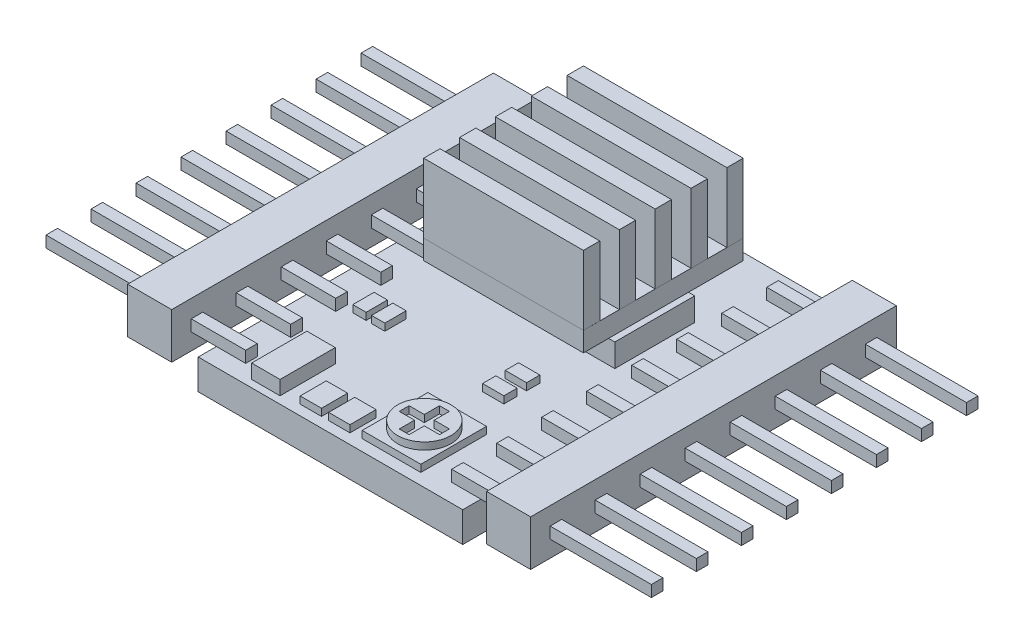
from build123d import *

# Parameters (mm, degrees)
SKETCH1_W            = 14.9
SKETCH1_H            = 20.45
BOARD_DEPTH          = 1.7
SKETCH2_W            = 11.25
SKETCH2_H            = 0.65
HEADERPINS_DEPTH     = 0.64
HEATSINK_START       = 1.3
SKETCH3_W            = 9
SKETCH3_H            = 9
HEATSINK_DEPTH       = 1.1
SKETCH4_W            = 8.998650171
SKETCH4_H            = 0.92
HEATSINKFINS_DEPTH   = 3.9
SKETCH4_W_2          = 9
HEATSINKFINS_2_DEPTH = 3.9
HEATSINKFINS_3_DEPTH = 3.9
HEATSINKFINS_4_DEPTH = 3.9
HEATSINKFINS_5_DEPTH = 3.9
SKETCH5_W            = 0.75
SKETCH5_H            = 1.2
SKETCH5_W_2          = 1.2
SKETCH5_H_2          = 0.75
SKETCH5_W_3          = 1.6
SKETCH5_H_3          = 3.11
SKETCH5_H_4          = 1.472209915
SKETCH5_W_4          = 3.3
SKETCH5_H_5          = 3.7
COMPONENTS_DEPTH     = 0.4
SKETCH6_W            = 1.6
SKETCH6_H            = 3.11
SKETCH6_R            = 1.501657412
COMPONENTS2_DEPTH    = 0.4
MAINIC_REACH         = 34.303
SKETCH7_W            = 9.7
SKETCH7_H            = 4.5
HEADERPLASTIC_START  = 1
SKETCH8_W            = 2.48
SKETCH8_H            = 20.6
HEADERPLASTIC_DEPTH  = 2.57


with BuildPart() as part:
    # Sketch1 → Board (new body)
    with BuildSketch(Plane(origin=(0, 0, 0), x_dir=(1, 0, 0), z_dir=(0, 1, 0))):
        with Locations((7.45, 10.225)):
            Rectangle(SKETCH1_W, SKETCH1_H)
    extrude(amount=BOARD_DEPTH)

    # Sketch2 → HeaderPins (add)
    with BuildSketch(Plane(origin=(0, 1.7, 0), x_dir=(1, 0, 0), z_dir=(0, 1, 0))):
        with Locations((18.875, 19.1)):
            Rectangle(SKETCH2_W, SKETCH2_H)
        with Locations((18.875, 16.564285714)):
            Rectangle(SKETCH2_W, SKETCH2_H)
        with Locations((18.875, 14.028571429)):
            Rectangle(SKETCH2_W, SKETCH2_H)
        with Locations((18.875, 11.492857143)):
            Rectangle(SKETCH2_W, SKETCH2_H)
        with Locations((18.875, 8.957142857)):
            Rectangle(SKETCH2_W, SKETCH2_H)
        with Locations((18.875, 6.421428571)):
            Rectangle(SKETCH2_W, SKETCH2_H)
        with Locations((18.875, 3.885714286)):
            Rectangle(SKETCH2_W, SKETCH2_H)
        with Locations((18.875, 1.35)):
            Rectangle(SKETCH2_W, SKETCH2_H)
        with Locations((-3.975, 1.35)):
            Rectangle(SKETCH2_W, SKETCH2_H)
        with Locations((-3.975, 3.885714286)):
            Rectangle(SKETCH2_W, SKETCH2_H)
        with Locations((-3.975, 6.421428571)):
            Rectangle(SKETCH2_W, SKETCH2_H)
        with Locations((-3.975, 8.957142857)):
            Rectangle(SKETCH2_W, SKETCH2_H)
        with Locations((-3.975, 11.492857143)):
            Rectangle(SKETCH2_W, SKETCH2_H)
        with Locations((-3.975, 14.028571429)):
            Rectangle(SKETCH2_W, SKETCH2_H)
        with Locations((-3.975, 16.564285714)):
            Rectangle(SKETCH2_W, SKETCH2_H)
        with Locations((-3.975, 19.1)):
            Rectangle(SKETCH2_W, SKETCH2_H)
    extrude(amount=HEADERPINS_DEPTH)

    # Sketch5 → Components (add)
    with BuildSketch(Plane(origin=(0, 1.7, 0), x_dir=(1, 0, 0), z_dir=(0, 1, 0))):
        with Locations((2.571559001, 7.110946936)):
            Rectangle(SKETCH5_W, SKETCH5_H)
        with Locations((3.625, 7.110946936)):
            Rectangle(SKETCH5_W, SKETCH5_H)
        with Locations((10.3, 7.969336881)):
            Rectangle(SKETCH5_W_2, SKETCH5_H_2)
        with Locations((10.3, 6.690594644)):
            Rectangle(SKETCH5_W_2, SKETCH5_H_2)
        with Locations((3.398444658, 1.965399137)):
            Rectangle(SKETCH5_W_3, SKETCH5_H_3)
        with Locations((5.770870014, 1.307842168)):
            Rectangle(SKETCH5_W_2, SKETCH5_H_4)
        with Locations((7.37452682, 1.307842168)):
            Rectangle(SKETCH5_W_2, SKETCH5_H_4)
        with Locations((10.25, 2.486333165)):
            Rectangle(SKETCH5_W_4, SKETCH5_H_5)
    extrude(amount=COMPONENTS_DEPTH)

    # Sketch6 → Components2 (add)
    # profile 1 of 2: a face of its own
    with BuildSketch(Plane(origin=(0, 2.1, 0), x_dir=(1, 0, 0), z_dir=(0, 1, 0))):
        with Locations((3.398444658, 1.965399137)):
            Rectangle(SKETCH6_W, SKETCH6_H)
    # profile 2 of 2: a face of its own
    with BuildSketch(Plane(origin=(0, 2.1, 0), x_dir=(1, 0, 0), z_dir=(0, 1, 0))):
        with Locations((10.25, 2.486333165)):
            Circle(SKETCH6_R)
        Polygon((10.528040347, 1.351004656), (9.971959653, 1.351004656), (9.971959653, 2.208292818), (9.114671492, 2.208292818), (9.114671492, 2.764373511), (9.971959653, 2.764373511), (9.971959653, 3.621661673), (10.528040347, 3.621661673), (10.528040347, 2.764373511), (11.385328508, 2.764373511), (11.385328508, 2.208292818), (10.528040347, 2.208292818), align=None, mode=Mode.SUBTRACT)
    extrude(amount=COMPONENTS2_DEPTH)

    # Sketch7 → MainIC (add, up to next)
    with BuildSketch(Plane.XZ.offset(-3), mode=Mode.PRIVATE) as mainic_sk1:
        with Locations((7.45, -13.416157465)):
            Rectangle(SKETCH7_W, SKETCH7_H)
    mainic_tool1 = extrude(mainic_sk1.sketch, amount=MAINIC_REACH, mode=Mode.PRIVATE) - part.part


with BuildPart() as body_2:
    # Sketch3 → HeatSink (new body)
    with BuildSketch(Plane(origin=(0, 1.7, 0), x_dir=(1, 0, 0), z_dir=(0, 1, 0)).offset(HEATSINK_START)):
        with Locations((7.45, 14.25)):
            Rectangle(SKETCH3_W, SKETCH3_H)
    extrude(amount=HEATSINK_DEPTH)


with BuildPart() as body_3:
    # Sketch4 → HeatSinkFins (new body)
    with BuildSketch(Plane(origin=(0, 4.1, 0), x_dir=(1, 0, 0), z_dir=(0, 1, 0))):
        with Locations((7.449325085, 10.21)):
            Rectangle(SKETCH4_W, SKETCH4_H)
    extrude(amount=HEATSINKFINS_DEPTH)


with BuildPart() as body_4:
    # Sketch4 → HeatSinkFins 2 (new body)
    with BuildSketch(Plane(origin=(0, 4.1, 0), x_dir=(1, 0, 0), z_dir=(0, 1, 0))):
        with Locations((7.45, 18.29)):
            Rectangle(SKETCH4_W_2, SKETCH4_H)
    extrude(amount=HEATSINKFINS_2_DEPTH)


with BuildPart() as body_5:
    # Sketch4 → HeatSinkFins 3 (new body)
    with BuildSketch(Plane(origin=(0, 4.1, 0), x_dir=(1, 0, 0), z_dir=(0, 1, 0))):
        with Locations((7.45, 16.27)):
            Rectangle(SKETCH4_W_2, SKETCH4_H)
    extrude(amount=HEATSINKFINS_3_DEPTH)


with BuildPart() as body_6:
    # Sketch4 → HeatSinkFins 4 (new body)
    with BuildSketch(Plane(origin=(0, 4.1, 0), x_dir=(1, 0, 0), z_dir=(0, 1, 0))):
        with Locations((7.45, 14.25)):
            Rectangle(SKETCH4_W_2, SKETCH4_H)
    extrude(amount=HEATSINKFINS_4_DEPTH)


with BuildPart() as body_7:
    # Sketch4 → HeatSinkFins 5 (new body)
    with BuildSketch(Plane(origin=(0, 4.1, 0), x_dir=(1, 0, 0), z_dir=(0, 1, 0))):
        with Locations((7.45, 12.23)):
            Rectangle(SKETCH4_W_2, SKETCH4_H)
    extrude(amount=HEATSINKFINS_5_DEPTH)


with BuildPart() as part_1:
    add(part.part)

    add(body_2.part)  # MainIC merges body 2
    add(mainic_tool1.solids().sort_by_distance((7.45, 3, -13.416157))[0])

    # Sketch8 → HeaderPlastic (add)
    with BuildSketch(Plane(origin=(0, 2.34, 0), x_dir=(1, 0, 0), z_dir=(0, 1, 0)).offset(HEADERPLASTIC_START)):
        with Locations((-2.66, 10.225)):
            Rectangle(SKETCH8_W, SKETCH8_H)
        with Locations((17.56, 10.225)):
            Rectangle(SKETCH8_W, SKETCH8_H)
    extrude(amount=-HEADERPLASTIC_DEPTH)


solid = Compound([body_3.part, body_4.part, body_5.part, body_6.part, body_7.part, part_1.part])
